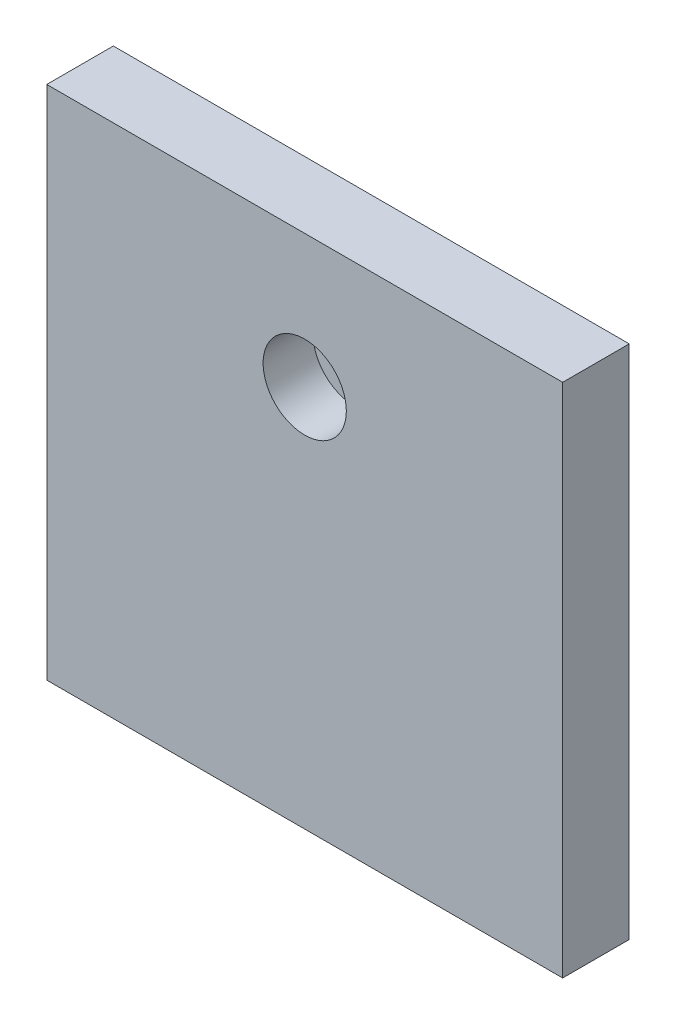
from build123d import *

# Parameters (mm, degrees)
CROQUIS1_W              = 31
CROQUIS1_H              = 31
CROQUIS1_R              = 1.25
SALIENTE_EXTRUIR1_DEPTH = 4
CROQUIS2_R              = 2.5
CORTAR_EXTRUIR1_DEPTH   = 3


with BuildPart() as part:
    # Croquis1 → Saliente-Extruir1 (new body)
    with BuildSketch(Plane.XY):
        with Locations((15.5, -15.5)):
            Rectangle(CROQUIS1_W, CROQUIS1_H)
        with Locations((15.5, -8)):
            Circle(CROQUIS1_R, mode=Mode.SUBTRACT)
    extrude(amount=SALIENTE_EXTRUIR1_DEPTH)

    # Croquis2 → Cortar-Extruir1 (cut)
    with BuildSketch(Plane.XY.offset(4)):
        with Locations((15.5, -8)):
            Circle(CROQUIS2_R)
    extrude(amount=-CORTAR_EXTRUIR1_DEPTH, mode=Mode.SUBTRACT)


solid = part.part
